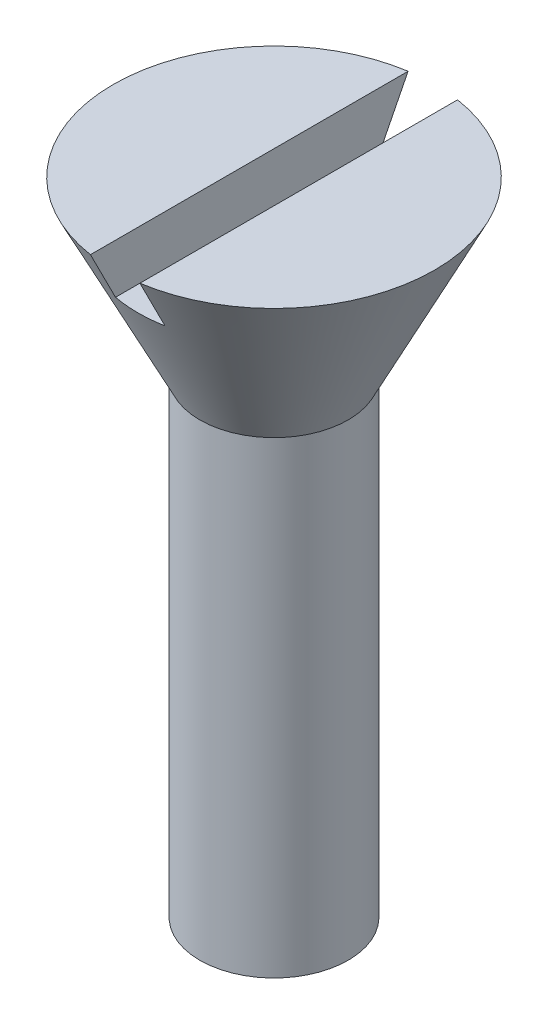
from build123d import *

# Parameters (mm, degrees)
CUT_EXTRUDE1_DEPTH      = 23.609258984
CUT_EXTRUDE1_DEPTH_BACK = 23.609258984
SKETCH3_W               = 2
SKETCH3_H               = 2


with BuildPart() as part:
    # Sketch1 → Revolve3 (revolve)
    with BuildSketch(Plane.XY, mode=Mode.PRIVATE) as revolve3_sk:
        Polygon((0, 0), (0, -18.924149032), (-3, -18.924149032), (-3, 0), (-6.5, 7), (-1, 7), (-1, 5), (0, 5), align=None)
    revolve(revolve3_sk.sketch.rotate(Axis((0, 5, 0), (0, -1, 0)), 270), axis=Axis((0, 5, 0), (0, -1, 0)))

    # Sketch2 → Revolve4 (revolve)
    with BuildSketch(Plane.XY, mode=Mode.PRIVATE) as revolve4_sk:
        Polygon((-3, -18.924149032), (0, -20.656199839), (0, -18.924149032), align=None)
    revolve(revolve4_sk.sketch.rotate(Axis((0, -18.924149032, 0), (0, -1, 0)), 270), axis=Axis((0, -18.924149032, 0), (0, -1, 0)))

    # Sketch3 → Cut-Extrude1 (cut, two sides: drawn at the far end of the back side and taken through both)
    with BuildSketch(Plane.XY.offset(-CUT_EXTRUDE1_DEPTH_BACK)):
        with Locations((0, 6)):
            Rectangle(SKETCH3_W, SKETCH3_H)
    extrude(amount=CUT_EXTRUDE1_DEPTH + CUT_EXTRUDE1_DEPTH_BACK, mode=Mode.SUBTRACT)


solid = part.part
